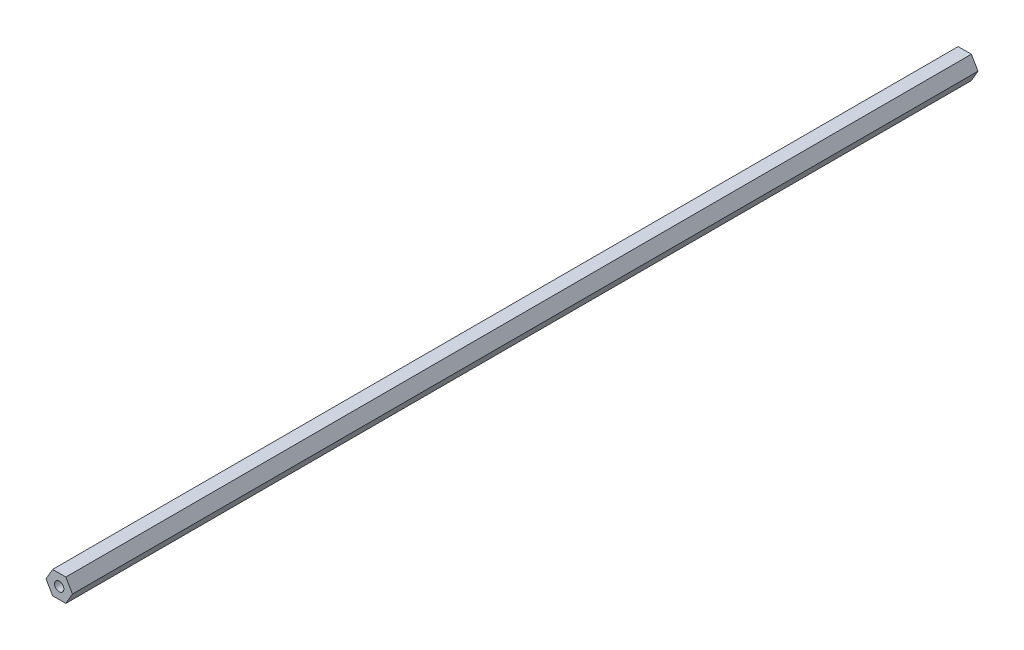
from build123d import *

# Parameters (mm, degrees)
BOSS_EXTRUDE1_DEPTH = 502.3485
SKETCH1_R           = 2.5796875
CUT_EXTRUDE1_DEPTH  = 503.442137251


with BuildPart() as part:
    # Sketch 1 → Boss-Extrude1 (new body)
    with BuildSketch(Plane.XY):
        Polygon((7.332348419, 0), (3.666174209, 6.35), (-3.666174209, 6.35), (-7.332348419, 0), (-3.666174209, -6.35), (3.666174209, -6.35), align=None)
    extrude(amount=BOSS_EXTRUDE1_DEPTH)

    # Sketch1 → Cut-Extrude1 (cut, through all)
    with BuildSketch(Plane.XY.offset(502.3485)):
        Circle(SKETCH1_R)
    extrude(amount=-CUT_EXTRUDE1_DEPTH, mode=Mode.SUBTRACT)


solid = part.part
